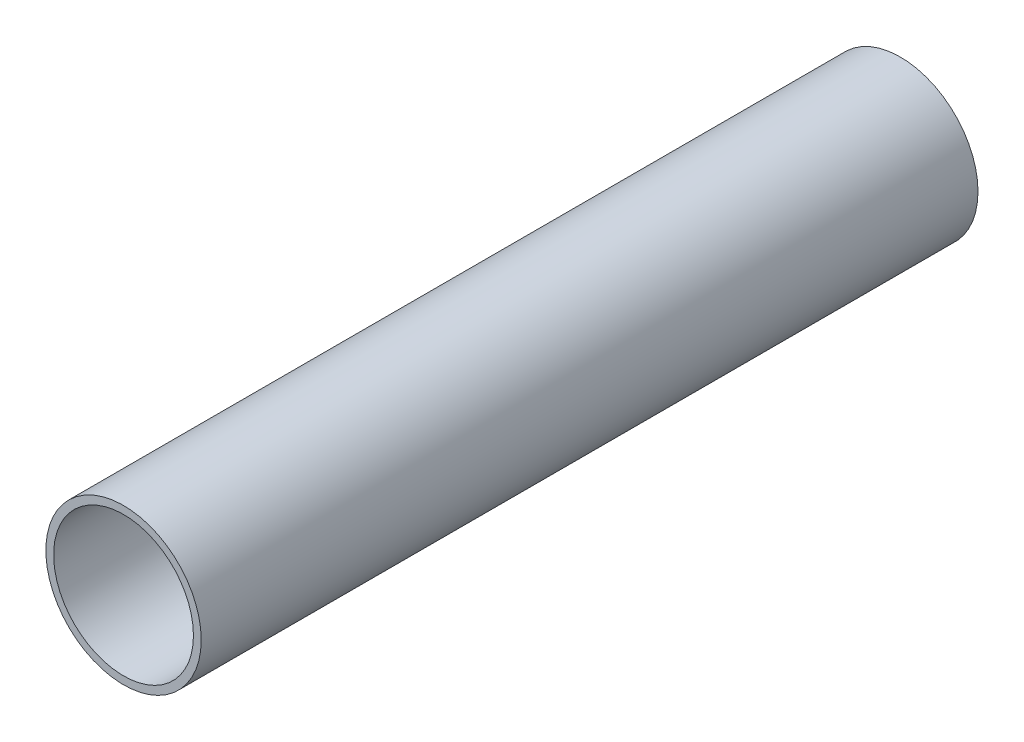
from build123d import *

# Parameters (mm, degrees)
SKETCH1_R           = 10
SKETCH1_R_2         = 9
BOSS_EXTRUDE1_DEPTH = 100


with BuildPart() as part:
    # Sketch1 → Boss-Extrude1 (new body)
    with BuildSketch(Plane.XY):
        Circle(SKETCH1_R)
        Circle(SKETCH1_R_2, mode=Mode.SUBTRACT)
    extrude(amount=BOSS_EXTRUDE1_DEPTH)


solid = part.part
